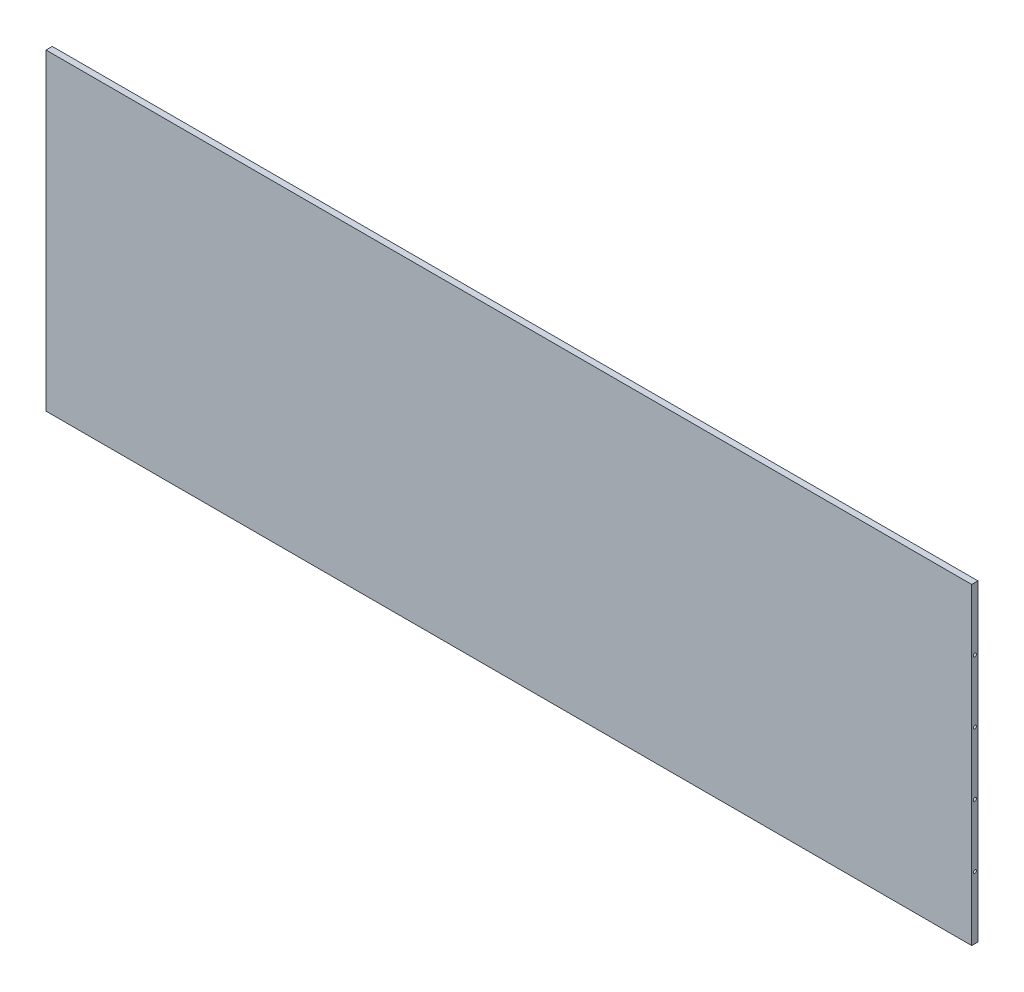
from build123d import *

# Parameters (mm, degrees)
CROQUIS1_W              = 1480
CROQUIS1_H              = 500
SALIENTE_EXTRUIR1_DEPTH = 5
CROQUIS2_R              = 2.5
CORTAR_EXTRUIR1_DEPTH   = 5
CROQUIS3_R              = 2.5
CORTAR_EXTRUIR2_DEPTH   = 5


with BuildPart() as part:
    # Croquis1 → Saliente-Extruir1 (new, symmetric)
    with BuildSketch(Plane.XY):
        Rectangle(CROQUIS1_W, CROQUIS1_H)
    extrude(amount=SALIENTE_EXTRUIR1_DEPTH, both=True)

    # Croquis2 → Cortar-Extruir1 (cut)
    with BuildSketch(Plane.XZ.offset(250)):
        with Locations(Location((-690, 0, 0), (0, 0, 270))):
            Circle(CROQUIS2_R)
        with Locations(Location((-590, 0, 0), (0, 0, 270))):
            Circle(CROQUIS2_R)
        with Locations(Location((-490, 0, 0), (0, 0, 270))):
            Circle(CROQUIS2_R)
        with Locations(Location((-390, 0, 0), (0, 0, 270))):
            Circle(CROQUIS2_R)
        with Locations(Location((-290, 0, 0), (0, 0, 270))):
            Circle(CROQUIS2_R)
        with Locations(Location((-190, 0, 0), (0, 0, 270))):
            Circle(CROQUIS2_R)
        with Locations(Location((-90, 0, 0), (0, 0, 270))):
            Circle(CROQUIS2_R)
        with Locations(Location((10, 0, 0), (0, 0, 270))):
            Circle(CROQUIS2_R)
        with Locations(Location((110, 0, 0), (0, 0, 270))):
            Circle(CROQUIS2_R)
        with Locations(Location((210, 0, 0), (0, 0, 270))):
            Circle(CROQUIS2_R)
        with Locations(Location((310, 0, 0), (0, 0, 270))):
            Circle(CROQUIS2_R)
        with Locations(Location((410, 0, 0), (0, 0, 270))):
            Circle(CROQUIS2_R)
        with Locations(Location((510, 0, 0), (0, 0, 270))):
            Circle(CROQUIS2_R)
        with Locations(Location((610, 0, 0), (0, 0, 270))):
            Circle(CROQUIS2_R)
        with Locations(Location((710, 0, 0), (0, 0, 270))):
            Circle(CROQUIS2_R)
    extrude(amount=-CORTAR_EXTRUIR1_DEPTH, mode=Mode.SUBTRACT)

    # Croquis3 → Cortar-Extruir2 (cut)
    with BuildSketch(Plane.ZY.offset(740)):
        with Locations((0, -150)):
            Circle(CROQUIS3_R)
        with Locations((0, -50)):
            Circle(CROQUIS3_R)
        with Locations((0, 50)):
            Circle(CROQUIS3_R)
        with Locations((0, 150)):
            Circle(CROQUIS3_R)
    cortar_extruir2 = extrude(amount=-CORTAR_EXTRUIR2_DEPTH, mode=Mode.SUBTRACT)

    # Simetría5: Cortar-Extruir2 across plane
    add(cortar_extruir2.mirror(Plane(origin=(0, 0, 0), x_dir=(0, 0, 1), z_dir=(1, 0, 0))), mode=Mode.SUBTRACT)


solid = part.part
